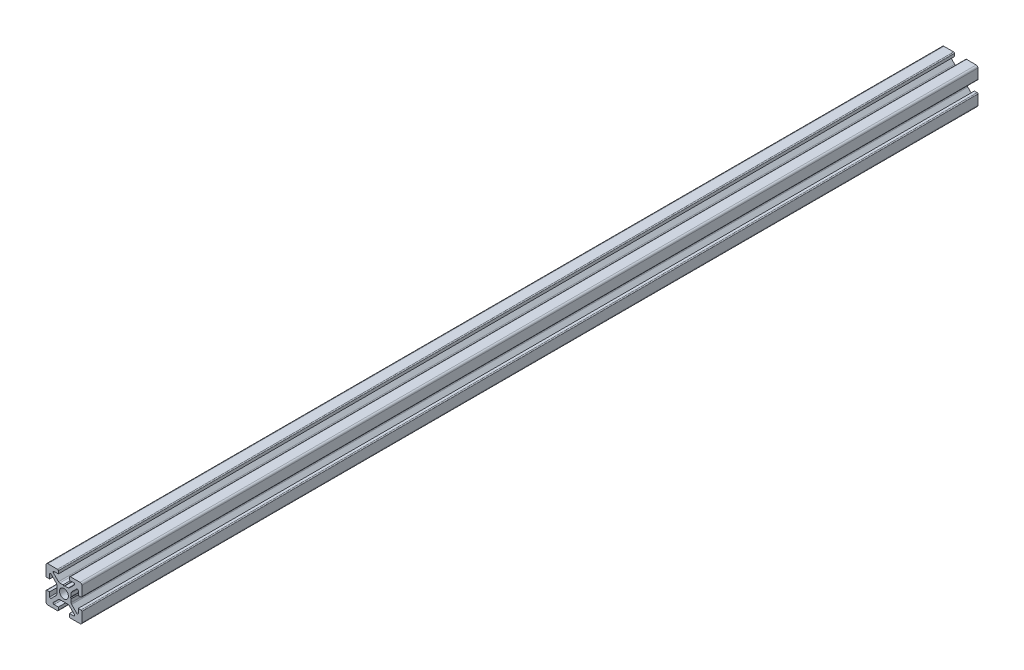
from build123d import *

# Parameters (mm, degrees)
SKETCH_1_R      = 2.5
EXTRUDE_1_DEPTH = 500


with BuildPart() as part:
    # 草图1 → 凸台-拉伸1 (new body)
    with BuildSketch(Plane.XY):
        with BuildLine():
            Line((16.486773435, 27.123343944), (19.340326826, 24.269790554))
            ThreePointArc((19.340326826, 24.269790554), (19.885221932, 24.161404178), (20.193880216, 24.623343944))
            Line((20.193880216, 24.623343944), (20.193880216, 27.043444957))
            Line((20.193880216, 27.043444957), (21.693880216, 27.043444957))
            ThreePointArc((21.693880216, 27.043444957), (22.047433607, 26.896998348), (22.193880216, 26.543444957))
            Line((22.193880216, 26.543444957), (22.193880216, 21.143444957))
            ThreePointArc((22.193880216, 21.143444957), (21.900986997, 20.436338176), (21.193880216, 20.143444957))
            Line((21.193880216, 20.143444957), (15.793880216, 20.143444957))
            ThreePointArc((15.793880216, 20.143444957), (15.440326826, 20.289891566), (15.293880216, 20.643444957))
            Line((15.293880216, 20.643444957), (15.293880216, 22.143444957))
            Line((15.293880216, 22.143444957), (17.713981229, 22.143444957))
            ThreePointArc((17.713981229, 22.143444957), (18.175920995, 22.452103241), (18.06753462, 22.996998348))
            Line((18.06753462, 22.996998348), (15.213981229, 25.850551738))
            ThreePointArc((15.213981229, 25.850551738), (14.88955788, 26.06732449), (14.506874448, 26.143444957))
            Line((14.506874448, 26.143444957), (12.713495459, 26.143444957))
            Line((12.713495459, 26.143444957), (12.193880216, 26.443444957))
            Line((12.193880216, 26.443444957), (11.674264974, 26.143444957))
            Line((11.674264974, 26.143444957), (9.880885985, 26.143444957))
            ThreePointArc((9.880885985, 26.143444957), (9.498202552, 26.06732449), (9.173779204, 25.850551738))
            Line((9.173779204, 25.850551738), (6.320225813, 22.996998348))
            ThreePointArc((6.320225813, 22.996998348), (6.211839437, 22.452103241), (6.673779204, 22.143444957))
            Line((6.673779204, 22.143444957), (9.093880216, 22.143444957))
            Line((9.093880216, 22.143444957), (9.093880216, 20.643444957))
            ThreePointArc((9.093880216, 20.643444957), (8.947433607, 20.289891566), (8.593880216, 20.143444957))
            Line((8.593880216, 20.143444957), (3.193880216, 20.143444957))
            ThreePointArc((3.193880216, 20.143444957), (2.486773435, 20.436338176), (2.193880216, 21.143444957))
            Line((2.193880216, 21.143444957), (2.193880216, 26.543444957))
            ThreePointArc((2.193880216, 26.543444957), (2.340326826, 26.896998348), (2.693880216, 27.043444957))
            Line((2.693880216, 27.043444957), (4.193880216, 27.043444957))
            Line((4.193880216, 27.043444957), (4.193880216, 24.623343944))
            ThreePointArc((4.193880216, 24.623343944), (4.5025385, 24.161404178), (5.047433607, 24.269790554))
            Line((5.047433607, 24.269790554), (7.900986997, 27.123343944))
            ThreePointArc((7.900986997, 27.123343944), (8.117759749, 27.447767293), (8.193880216, 27.830450726))
            Line((8.193880216, 27.830450726), (8.193880216, 29.623829715))
            Line((8.193880216, 29.623829715), (8.493880216, 30.143444957))
            Line((8.493880216, 30.143444957), (8.193880216, 30.663060199))
            Line((8.193880216, 30.663060199), (8.193880216, 32.456439189))
            ThreePointArc((8.193880216, 32.456439189), (8.117759749, 32.839122621), (7.900986997, 33.16354597))
            Line((7.900986997, 33.16354597), (5.047433607, 36.01709936))
            ThreePointArc((5.047433607, 36.01709936), (4.5025385, 36.125485736), (4.193880216, 35.66354597))
            Line((4.193880216, 35.66354597), (4.193880216, 33.243444957))
            Line((4.193880216, 33.243444957), (2.693880216, 33.243444957))
            ThreePointArc((2.693880216, 33.243444957), (2.340326826, 33.389891566), (2.193880216, 33.743444957))
            Line((2.193880216, 33.743444957), (2.193880216, 39.143444957))
            ThreePointArc((2.193880216, 39.143444957), (2.486773435, 39.850551738), (3.193880216, 40.143444957))
            Line((3.193880216, 40.143444957), (8.593880216, 40.143444957))
            ThreePointArc((8.593880216, 40.143444957), (8.947433607, 39.996998348), (9.093880216, 39.643444957))
            Line((9.093880216, 39.643444957), (9.093880216, 38.143444957))
            Line((9.093880216, 38.143444957), (6.673779204, 38.143444957))
            ThreePointArc((6.673779204, 38.143444957), (6.211839437, 37.834786673), (6.320225813, 37.289891566))
            Line((6.320225813, 37.289891566), (9.173779204, 34.436338176))
            ThreePointArc((9.173779204, 34.436338176), (9.498202552, 34.219565425), (9.880885985, 34.143444957))
            Line((9.880885985, 34.143444957), (11.674264974, 34.143444957))
            Line((11.674264974, 34.143444957), (12.193880216, 33.843444957))
            Line((12.193880216, 33.843444957), (12.713495459, 34.143444957))
            Line((12.713495459, 34.143444957), (14.506874448, 34.143444957))
            ThreePointArc((14.506874448, 34.143444957), (14.88955788, 34.219565425), (15.213981229, 34.436338176))
            Line((15.213981229, 34.436338176), (18.06753462, 37.289891566))
            ThreePointArc((18.06753462, 37.289891566), (18.175920995, 37.834786673), (17.713981229, 38.143444957))
            Line((17.713981229, 38.143444957), (15.293880216, 38.143444957))
            Line((15.293880216, 38.143444957), (15.293880216, 39.643444957))
            ThreePointArc((15.293880216, 39.643444957), (15.440326826, 39.996998348), (15.793880216, 40.143444957))
            Line((15.793880216, 40.143444957), (21.193880216, 40.143444957))
            ThreePointArc((21.193880216, 40.143444957), (21.900986997, 39.850551738), (22.193880216, 39.143444957))
            Line((22.193880216, 39.143444957), (22.193880216, 33.743444957))
            ThreePointArc((22.193880216, 33.743444957), (22.047433607, 33.389891566), (21.693880216, 33.243444957))
            Line((21.693880216, 33.243444957), (20.193880216, 33.243444957))
            Line((20.193880216, 33.243444957), (20.193880216, 35.66354597))
            ThreePointArc((20.193880216, 35.66354597), (19.885221932, 36.125485736), (19.340326826, 36.01709936))
            Line((19.340326826, 36.01709936), (16.486773435, 33.16354597))
            ThreePointArc((16.486773435, 33.16354597), (16.270000684, 32.839122621), (16.193880216, 32.456439189))
            Line((16.193880216, 32.456439189), (16.193880216, 30.663060199))
            Line((16.193880216, 30.663060199), (15.893880216, 30.143444957))
            Line((15.893880216, 30.143444957), (16.193880216, 29.623829715))
            Line((16.193880216, 29.623829715), (16.193880216, 27.830450726))
            ThreePointArc((16.193880216, 27.830450726), (16.270000684, 27.447767293), (16.486773435, 27.123343944))
        make_face()
        with Locations((12.193880216, 30.143444957)):
            Circle(SKETCH_1_R, mode=Mode.SUBTRACT)
    extrude(amount=EXTRUDE_1_DEPTH)


solid = part.part
